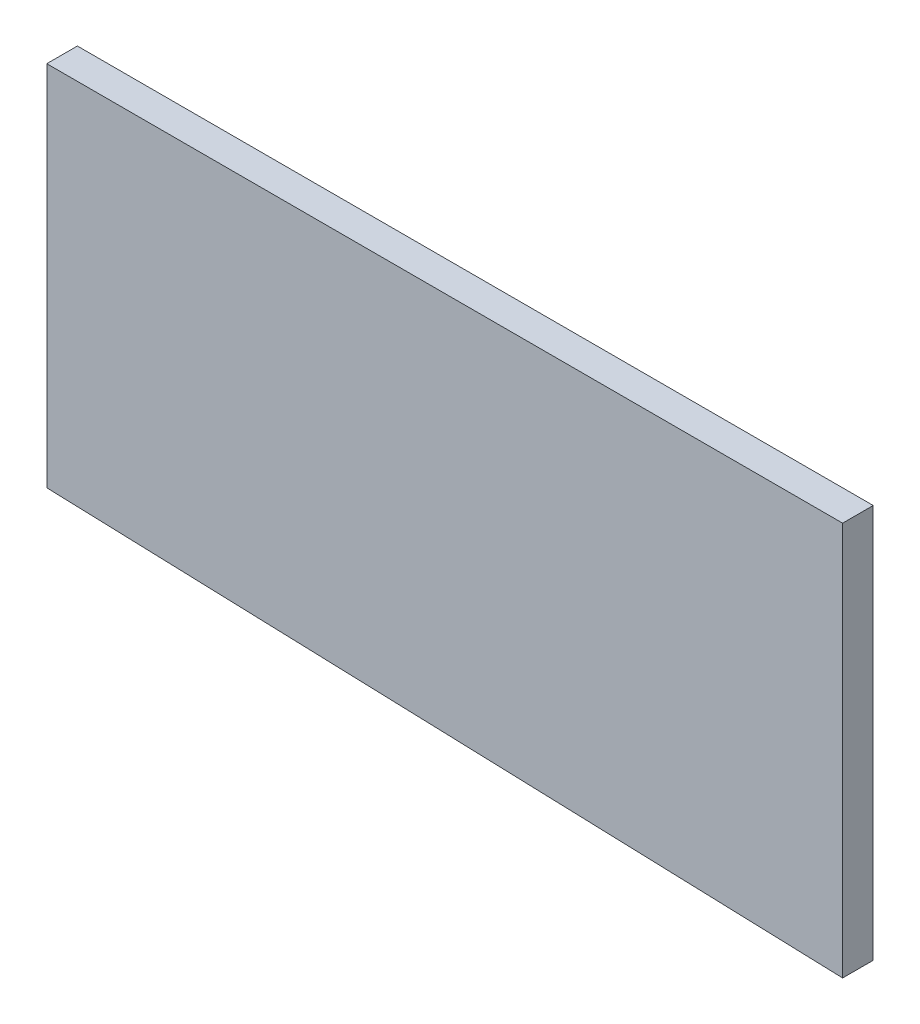
from build123d import *

# Parameters (mm, degrees)
BOSS_EXTRUDE1_DEPTH = 5


with BuildPart() as part:
    # Sketch1 → Boss-Extrude1 (new body)
    with BuildSketch(Plane.XY):
        Polygon((0, 0), (130, 0), (130, -64.346368715), (0, -60), align=None)
    extrude(amount=BOSS_EXTRUDE1_DEPTH)


solid = part.part
